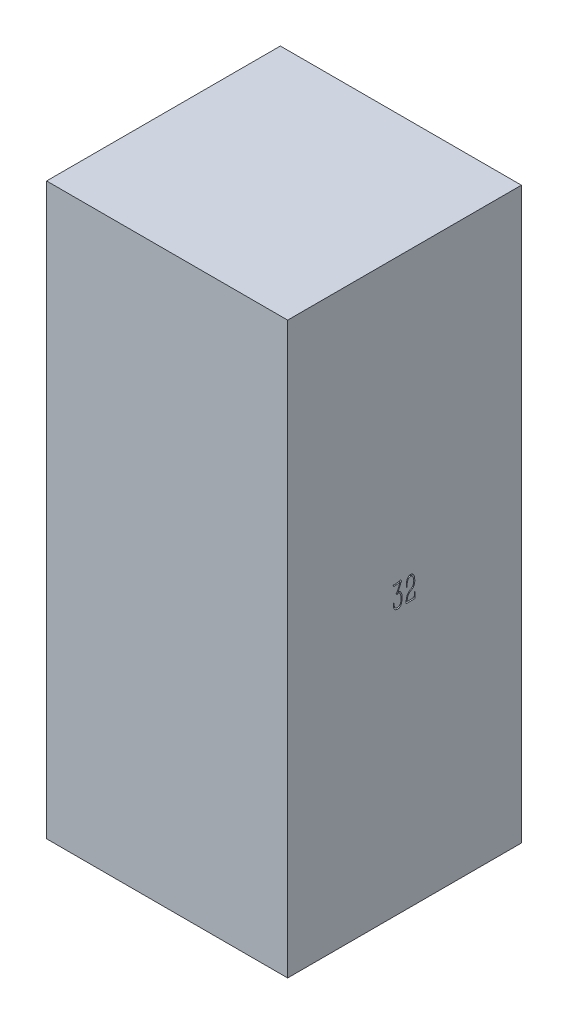
from build123d import *

# Parameters (mm, degrees)
SKETCH_1_W          = 33
SKETCH_1_H          = 32
EXTRUDE_1_DEPTH     = 78
CUT_EXTRUDE_1_DEPTH = 87.191646927


with BuildPart() as part:
    # 草图1 → 凸台-拉伸1 (new body)
    with BuildSketch(Plane(origin=(0, 0, 0), x_dir=(1, 0, 0), z_dir=(0, 1, 0))):
        Rectangle(SKETCH_1_W, SKETCH_1_H)
    extrude(amount=EXTRUDE_1_DEPTH)

    # 草图2 → 切除-拉伸1 (cut, through all)
    with BuildSketch(Plane(origin=(16.5, 0, 0), x_dir=(0, 0, -1), z_dir=(1, 0, 0))):
        with BuildLine():
            add(Edge.make_bspline(
                [(-1.038885982, 38.228516679), (-1.027714348, 38.251643724), (-1.006193656, 38.296194951), (-0.974803707, 38.360547894), (-0.945519745, 38.41963197), (-0.920473121, 38.474458428), (-0.897118283, 38.523818532), (-0.876317775, 38.568240699), (-0.858344735, 38.607739452), (-0.83942292, 38.651591526), (-0.819798108, 38.697339415), (-0.800799642, 38.742148303), (-0.786983733, 38.774156326), (-0.77984088, 38.791089242), (-0.777113129, 38.797555674)],
                knots=[0, 0, 0, 0, 1.475873638, 2.843077615, 4.114458223, 5.26483622, 6.306479236, 7.252326145, 8.083448402, 8.799989154, 9.996708352, 10.943956596, 11.596712522, 12, 12, 12, 12], degree=3))
            Line((-0.777113129, 38.797555674), (-0.616022142, 39.225640055))
            add(Edge.make_bspline(
                [(-0.616022142, 39.225640055), (-0.651058299, 39.222211364), (-0.727505466, 39.214730129), (-0.825065523, 39.208790014), (-0.906183214, 39.204464193), (-0.96184382, 39.199800071), (-1.010583628, 39.195440648), (-1.040630618, 39.192124024), (-1.054547606, 39.190587849)],
                knots=[0, 0, 0, 0, 1.440114021, 3.142257811, 3.998086789, 4.76330671, 5.427195687, 6, 6, 6, 6], degree=3))
            Line((-1.054547606, 39.190587849), (-1.20519751, 39.165230935))
            add(Edge.make_bspline(
                [(-1.20519751, 39.165230935), (-1.211928955, 39.163815759), (-1.230294176, 39.159954774), (-1.26425714, 39.149411618), (-1.31317008, 39.136445969), (-1.350399496, 39.125783436), (-1.371509038, 39.119737647)],
                knots=[0, 0, 0, 0, 0.478461291, 1.305373098, 2.472113022, 4, 4, 4, 4], degree=3))
            Line((-1.371509038, 39.119737647), (-1.421477075, 39.099601273))
            Line((-1.421477075, 39.099601273), (-1.547515856, 39.286049175))
            add(Edge.make_bspline(
                [(-1.547515856, 39.286049175), (-1.552838054, 39.293349003), (-1.561923614, 39.305810589), (-1.569466247, 39.32314591), (-1.575065045, 39.335189175), (-1.570047009, 39.347316759), (-1.55020422, 39.345498207), (-1.535222613, 39.334861508), (-1.516086913, 39.324627638), (-1.494070861, 39.323188308), (-1.46737961, 39.321621897), (-1.447817262, 39.324662265), (-1.437138699, 39.326321921)],
                knots=[0, 0, 0, 0, 1.323589942, 2.259509366, 2.829398404, 3.190947808, 3.965341466, 5.19662492, 6.050472624, 7.088782, 8.410843841, 10, 10, 10, 10], degree=3))
            Line((-1.437138699, 39.326321921), (-1.276047712, 39.331542462))
            Line((-1.276047712, 39.331542462), (-0.641379057, 39.406867414))
            Line((-0.641379057, 39.406867414), (-0.591411019, 39.452360702))
            Line((-0.591411019, 39.452360702), (-0.551138273, 39.492633449))
            add(Edge.make_bspline(
                [(-0.551138273, 39.492633449), (-0.549889297, 39.491146716), (-0.544769188, 39.485051937), (-0.533746512, 39.470549107), (-0.51414665, 39.447248367), (-0.499328282, 39.427830774), (-0.490729153, 39.416562705)],
                knots=[0, 0, 0, 0, 0.23984028, 0.983211964, 2.249351781, 4, 4, 4, 4], degree=3))
            Line((-0.490729153, 39.416562705), (-0.394522036, 39.295744465))
            add(Edge.make_bspline(
                [(-0.394522036, 39.295744465), (-0.388061576, 39.287356423), (-0.377325316, 39.273416826), (-0.36936029, 39.251123397), (-0.377522005, 39.236019085), (-0.388923428, 39.223071949), (-0.407405197, 39.207521447), (-0.422048399, 39.196700418), (-0.430320033, 39.190587849)],
                knots=[0, 0, 0, 0, 1.419029252, 2.358201718, 2.827787952, 3.596253847, 4.642174893, 6, 6, 6, 6], degree=3))
            Line((-0.430320033, 39.190587849), (-0.485508612, 39.145094561))
            add(Edge.make_bspline(
                [(-0.485508612, 39.145094561), (-0.501637146, 39.104561264), (-0.532238776, 39.027655022), (-0.576329661, 38.918204156), (-0.616674622, 38.820886602), (-0.652100293, 38.734852449), (-0.68463927, 38.661079557), (-0.711502119, 38.598481454), (-0.735687425, 38.548260079), (-0.750480425, 38.518861508), (-0.756976756, 38.505951156)],
                knots=[0, 0, 0, 0, 1.507300768, 2.859891598, 4.076963614, 5.147345159, 6.074452096, 6.862861548, 7.500626815, 8, 8, 8, 8], degree=3))
            Line((-0.756976756, 38.505951156), (-0.908372451, 38.218821389))
            add(Edge.make_bspline(
                [(-0.908372451, 38.218821389), (-0.890476993, 38.220250235), (-0.856204033, 38.222986727), (-0.803899263, 38.228210558), (-0.74691021, 38.221025225), (-0.696925881, 38.201034617), (-0.654397941, 38.176367739), (-0.620320296, 38.151730376), (-0.587764245, 38.119708699), (-0.55456708, 38.082064878), (-0.521292368, 38.037135024), (-0.490704435, 37.982715746), (-0.458862788, 37.920573796), (-0.41904114, 37.825870461), (-0.376012153, 37.699155467), (-0.34986844, 37.540000725), (-0.336951445, 37.380544042), (-0.335055137, 37.274425358), (-0.334112916, 37.221698013)],
                knots=[0, 0, 0, 0, 0.660541429, 1.265053373, 1.928435853, 2.750244091, 3.225390118, 3.735570922, 4.291687282, 4.900607759, 5.580848831, 6.342918567, 7.193367346, 8.147740655, 10.119512469, 12.097611575, 14.061014616, 16, 16, 16, 16], degree=3))
            add(Edge.make_bspline(
                [(-0.334112916, 37.221698013), (-0.336103278, 37.180418134), (-0.339884327, 37.101999617), (-0.349022227, 36.991188236), (-0.362658639, 36.893972309), (-0.382517741, 36.784369781), (-0.417540721, 36.663280557), (-0.460807169, 36.551564564), (-0.501888008, 36.471079549), (-0.536510023, 36.417710431), (-0.574431006, 36.369964935), (-0.615182047, 36.328182451), (-0.657571538, 36.293846016), (-0.698712477, 36.264315557), (-0.740342931, 36.243444389), (-0.794237281, 36.226008591), (-0.860097464, 36.213989988), (-0.912552267, 36.211582114), (-0.938204116, 36.210404598)],
                knots=[0, 0, 0, 0, 1.512752116, 2.8737433, 4.067977017, 5.104892351, 6.948544146, 8.672095895, 9.482011449, 10.251829035, 10.996496654, 11.710742831, 12.38300564, 12.991319199, 13.561044299, 14.079002633, 15.060579187, 16, 16, 16, 16], degree=3))
            add(Edge.make_bspline(
                [(-0.938204116, 36.210404598), (-0.960084051, 36.210031644), (-1.002178536, 36.209314125), (-1.063235482, 36.214284626), (-1.118844936, 36.225661195), (-1.170997369, 36.241137274), (-1.219839813, 36.265610902), (-1.266493793, 36.300571388), (-1.313459393, 36.343621204), (-1.358490003, 36.396451194), (-1.39970263, 36.456976868), (-1.435737867, 36.523926531), (-1.465678187, 36.596352373), (-1.495442642, 36.699424306), (-1.520670541, 36.831222982), (-1.52516496, 36.93792674), (-1.527379483, 36.990502616)],
                knots=[0, 0, 0, 0, 0.828828519, 1.594571005, 2.314948186, 2.97625877, 3.650192192, 4.371738268, 5.178272596, 6.059897072, 6.995131469, 7.947518938, 8.935744196, 9.957858231, 12.008325587, 14, 14, 14, 14], degree=3))
            Line((-1.527379483, 36.990502616), (-1.532600024, 37.186645808))
            Line((-1.532600024, 37.186645808), (-1.477411446, 37.186645808))
            add(Edge.make_bspline(
                [(-1.477411446, 37.186645808), (-1.473191248, 37.157559333), (-1.465109195, 37.101856154), (-1.453352921, 37.021490623), (-1.441176608, 36.948231997), (-1.427454246, 36.86153741), (-1.404600089, 36.764188739), (-1.366097804, 36.659416157), (-1.313883312, 36.570889935), (-1.25257707, 36.497938254), (-1.180875767, 36.444986161), (-1.104118335, 36.41158508), (-1.025888656, 36.395814524), (-0.974056431, 36.396010586), (-0.948645198, 36.396106707)],
                knots=[0, 0, 0, 0, 0.994021113, 1.903638599, 2.746793397, 3.505624798, 4.871908371, 6.122639036, 7.264652637, 8.331625701, 9.323760524, 10.250011688, 11.142051883, 12, 12, 12, 12], degree=3))
            add(Edge.make_bspline(
                [(-0.948645198, 36.396106707), (-0.928202243, 36.397869557), (-0.888162999, 36.401322246), (-0.830101748, 36.414466999), (-0.776406771, 36.436895996), (-0.726212639, 36.465577798), (-0.681032913, 36.502979856), (-0.640370916, 36.547051693), (-0.605935405, 36.599407979), (-0.567342898, 36.679562427), (-0.529836904, 36.790065922), (-0.501616623, 36.930424701), (-0.483253224, 37.073594381), (-0.474626199, 37.216047511), (-0.473450722, 37.356388578), (-0.484990609, 37.448237437), (-0.490729153, 37.493911949)],
                knots=[0, 0, 0, 0, 0.647840119, 1.268849254, 1.871153999, 2.479976942, 3.088343857, 3.716462885, 4.367721208, 5.059616847, 6.52246665, 8.039623249, 9.575767262, 11.078710543, 12.547304005, 14, 14, 14, 14], degree=3))
            add(Edge.make_bspline(
                [(-0.490729153, 37.493911949), (-0.498753335, 37.543142341), (-0.514615295, 37.640459496), (-0.551307071, 37.757268599), (-0.587438238, 37.844492672), (-0.619673512, 37.903013083), (-0.656210787, 37.955285656), (-0.697598223, 37.999127435), (-0.739553474, 38.035104445), (-0.781665356, 38.059111007), (-0.823253061, 38.071464266), (-0.849901513, 38.068748336), (-0.862879163, 38.067425693)],
                knots=[0, 0, 0, 0, 2.019199264, 3.991492233, 4.943861116, 5.841091039, 6.693606335, 7.520378909, 8.278781735, 8.923571305, 9.475785111, 10, 10, 10, 10], degree=3))
            Line((-0.862879163, 38.067425693), (-0.943424657, 38.057730402))
            Line((-0.943424657, 38.057730402), (-0.978476862, 37.992100741))
            add(Edge.make_bspline(
                [(-0.978476862, 37.992100741), (-0.983155388, 37.98392165), (-0.991311206, 37.969663488), (-1.002456044, 37.95081741), (-1.011357288, 37.939778827), (-1.018113534, 37.930262759), (-1.027880249, 37.933463977), (-1.034162217, 37.944402947), (-1.044204522, 37.960506644), (-1.050736949, 37.974337369), (-1.054547606, 37.98240545)],
                knots=[0, 0, 0, 0, 1.659028505, 2.892093886, 3.763458346, 4.288089223, 4.647361994, 5.327919393, 6.441255868, 8, 8, 8, 8], degree=3))
            Line((-1.054547606, 37.98240545), (-1.135093099, 38.138275895))
            add(Edge.make_bspline(
                [(-1.135093099, 38.138275895), (-1.140915084, 38.147234322), (-1.151064464, 38.162851415), (-1.146664433, 38.180653606), (-1.14478839, 38.188243933)],
                knots=[0, 0, 0, 0, 1.147259222, 2, 2, 2, 2], degree=3))
            Line((-1.14478839, 38.188243933), (-1.104515643, 38.203905556))
            Line((-1.104515643, 38.203905556), (-1.038885982, 38.228516679))
        make_face()
        with BuildLine():
            Line((0.331878987, 38.153191727), (0.255808243, 38.153191727))
            add(Edge.make_bspline(
                [(0.255808243, 38.153191727), (0.254240839, 38.177300982), (0.251252708, 38.223263368), (0.248169364, 38.288902643), (0.246867253, 38.347838686), (0.245562836, 38.419688629), (0.247574575, 38.510300489), (0.252976263, 38.583284838), (0.255808243, 38.621548855)],
                knots=[0, 0, 0, 0, 0.927540379, 1.768282303, 2.522502339, 3.190652681, 4.527123766, 6, 6, 6, 6], degree=3))
            add(Edge.make_bspline(
                [(0.255808243, 38.621548855), (0.257768151, 38.649915132), (0.261558387, 38.704772262), (0.271561391, 38.783834768), (0.283137898, 38.857099144), (0.298188453, 38.926009698), (0.318524233, 38.993445558), (0.347474415, 39.061274413), (0.383580747, 39.131819478), (0.426239419, 39.202611423), (0.473046057, 39.269409306), (0.525584565, 39.323766554), (0.580570385, 39.365197751), (0.639073992, 39.389855627), (0.695245931, 39.405189309), (0.746470136, 39.417250883), (0.792501716, 39.425680293), (0.821584447, 39.426579893), (0.83528832, 39.427003788)],
                knots=[0, 0, 0, 0, 1.238521709, 2.395159043, 3.470603583, 4.46912877, 5.466066804, 6.534123646, 7.677244524, 8.916145015, 10.13365226, 11.221244199, 12.198275335, 13.109907183, 13.966820176, 14.733954848, 15.403435577, 16, 16, 16, 16], degree=3))
            add(Edge.make_bspline(
                [(0.83528832, 39.427003788), (0.852752515, 39.425716106), (0.887261225, 39.423171686), (0.938022581, 39.411382691), (0.987047632, 39.394384721), (1.049752327, 39.3641047), (1.123075375, 39.316629803), (1.185453754, 39.2542874), (1.22861782, 39.197221083), (1.259022673, 39.148653235), (1.28596617, 39.09442048), (1.319802273, 39.015618442), (1.355199542, 38.911047419), (1.380726244, 38.778973493), (1.397093335, 38.6418206), (1.404581802, 38.501609039), (1.405974202, 38.362779422), (1.397822468, 38.272236997), (1.393886232, 38.228516679)],
                knots=[0, 0, 0, 0, 0.570779476, 1.127842599, 1.694919432, 2.261066821, 3.397481896, 4.527710891, 5.118384485, 5.730727279, 6.394748858, 7.092559246, 8.529363642, 9.986910621, 11.474321506, 13.03467297, 14.568129345, 16, 16, 16, 16], degree=3))
            add(Edge.make_bspline(
                [(1.393886232, 38.228516679), (1.385906857, 38.183544432), (1.369829054, 38.092928943), (1.335199368, 37.983829144), (1.30290326, 37.900885181), (1.275902019, 37.845304277), (1.247051459, 37.796099689), (1.205333722, 37.737910388), (1.141625289, 37.671859028), (1.082589031, 37.627564221), (1.051567885, 37.604289106)],
                knots=[0, 0, 0, 0, 1.490916612, 3.004077927, 3.729534125, 4.397912905, 5.020560084, 5.590839424, 6.734084393, 8, 8, 8, 8], degree=3))
            Line((1.051567885, 37.604289106), (0.804710864, 37.448418661))
            add(Edge.make_bspline(
                [(0.804710864, 37.448418661), (0.77325386, 37.427062896), (0.713605377, 37.386568291), (0.633958184, 37.320422257), (0.567107684, 37.250726173), (0.516578589, 37.173662925), (0.477333678, 37.094337126), (0.442485445, 37.014686269), (0.416176801, 36.926892692), (0.397465071, 36.848200837), (0.38470429, 36.782111519), (0.378312159, 36.736019418), (0.373119419, 36.695282655), (0.372460805, 36.669825836), (0.372151734, 36.65787956)],
                knots=[0, 0, 0, 0, 1.453572249, 2.75625039, 3.953730064, 5.132566341, 6.263730064, 7.337486329, 8.453238547, 9.76321854, 10.430854957, 11.026567013, 11.543191201, 12, 12, 12, 12], degree=3))
            Line((0.372151734, 36.65787956), (0.361710651, 36.446820536))
            Line((0.361710651, 36.446820536), (1.262626909, 36.4766522))
            add(Edge.make_bspline(
                [(1.262626909, 36.4766522), (1.274187187, 36.477298565), (1.294491628, 36.478433838), (1.314005443, 36.499707224), (1.318348992, 36.525682045), (1.326056351, 36.557630327), (1.331786243, 36.603425338), (1.336206455, 36.638251692), (1.338697653, 36.65787956)],
                knots=[0, 0, 0, 0, 0.925905201, 1.626257371, 2.181371879, 3.087088273, 4.358305093, 6, 6, 6, 6], degree=3))
            Line((1.338697653, 36.65787956), (1.358834026, 37.096405024))
            Line((1.358834026, 37.096405024), (1.428938437, 37.096405024))
            Line((1.428938437, 37.096405024), (1.454295352, 36.431904704))
            add(Edge.make_bspline(
                [(1.454295352, 36.431904704), (1.455143047, 36.418986094), (1.456625667, 36.396391431), (1.457347387, 36.366501958), (1.457367814, 36.345689435), (1.457053045, 36.328885435), (1.451640855, 36.31419338), (1.446611843, 36.297145761), (1.426994135, 36.28751466), (1.398795072, 36.284433131), (1.355938767, 36.280068855), (1.322302919, 36.280347987), (1.302899656, 36.280509008)],
                knots=[0, 0, 0, 0, 1.385018147, 2.4223982, 3.193529914, 3.619812046, 4.200562765, 4.878496499, 5.402948042, 6.404258339, 7.925751149, 10, 10, 10, 10], degree=3))
            Line((1.302899656, 36.280509008), (0.301301531, 36.255152094))
            add(Edge.make_bspline(
                [(0.301301531, 36.255152094), (0.289126092, 36.255116475), (0.265127402, 36.255046268), (0.240534408, 36.278910242), (0.230210776, 36.308124386), (0.22504384, 36.342486081), (0.221582902, 36.388072674), (0.219920481, 36.466478813), (0.223474684, 36.578038699), (0.231480424, 36.670093124), (0.23567187, 36.71828868)],
                knots=[0, 0, 0, 0, 0.556373901, 1.096654043, 1.476064089, 2.012759395, 2.73145082, 3.635924119, 5.715166189, 8, 8, 8, 8], degree=3))
            add(Edge.make_bspline(
                [(0.23567187, 36.71828868), (0.23939143, 36.746420361), (0.246556593, 36.800611745), (0.261125049, 36.878617474), (0.276657384, 36.951024253), (0.293514067, 37.017788276), (0.312123017, 37.078557814), (0.332434633, 37.133263296), (0.353490754, 37.18278578), (0.385118138, 37.238808669), (0.425314083, 37.299875504), (0.471034762, 37.365720253), (0.515054872, 37.421574282), (0.572591302, 37.483022717), (0.650484611, 37.550094295), (0.715919947, 37.599205767), (0.749522285, 37.62442548)],
                knots=[0, 0, 0, 0, 1.103491021, 2.125706759, 3.085324024, 3.98349739, 4.803138144, 5.555704107, 6.252741852, 6.89323317, 8.054555834, 9.09539633, 10.010480884, 10.817709087, 12.365830683, 14, 14, 14, 14], degree=3))
            Line((0.749522285, 37.62442548), (0.95610656, 37.755684802))
            add(Edge.make_bspline(
                [(0.95610656, 37.755684802), (0.972645841, 37.766681121), (1.004384519, 37.787782923), (1.048222374, 37.821378704), (1.08559579, 37.856236716), (1.117802981, 37.893853063), (1.146958535, 37.937380511), (1.170902845, 37.991636793), (1.196216323, 38.055545469), (1.225730433, 38.154975428), (1.256161613, 38.286214232), (1.26782723, 38.448364943), (1.261595352, 38.612618538), (1.242543328, 38.721638552), (1.232795245, 38.7774193)],
                knots=[0, 0, 0, 0, 0.635613896, 1.219735276, 1.765761318, 2.268061313, 2.802129131, 3.435697723, 4.161225462, 5.001884758, 6.75303811, 8.46119913, 10.189351173, 12, 12, 12, 12], degree=3))
            add(Edge.make_bspline(
                [(1.232795245, 38.7774193), (1.225449899, 38.805856301), (1.211124036, 38.861317895), (1.184009296, 38.941212483), (1.148910925, 39.013978554), (1.111343409, 39.081953238), (1.064278412, 39.141454573), (1.001587126, 39.184188367), (0.927525879, 39.212754922), (0.873351943, 39.217785328), (0.844983611, 39.220419513)],
                knots=[0, 0, 0, 0, 1.101106684, 2.147523679, 3.156537618, 4.125318695, 5.058520457, 5.968677808, 6.93629249, 8, 8, 8, 8], degree=3))
            add(Edge.make_bspline(
                [(0.844983611, 39.220419513), (0.830051215, 39.22057239), (0.800267504, 39.220877313), (0.755905982, 39.214150011), (0.71275829, 39.200044694), (0.656079874, 39.174479587), (0.590586824, 39.126858713), (0.521650462, 39.055007838), (0.464788926, 38.967276356), (0.421009898, 38.86561157), (0.388091328, 38.749787664), (0.361367893, 38.619980531), (0.343820516, 38.47454406), (0.338918079, 38.372749459), (0.336353737, 38.319503255)],
                knots=[0, 0, 0, 0, 0.469335518, 0.936122588, 1.403629858, 1.893624907, 2.887406355, 3.927357629, 5.011993806, 6.157121359, 7.396943717, 8.794309501, 10.323183677, 12, 12, 12, 12], degree=3))
            Line((0.336353737, 38.319503255), (0.331878987, 38.153191727))
        make_face()
    extrude(amount=-CUT_EXTRUDE_1_DEPTH, mode=Mode.SUBTRACT)


solid = part.part
